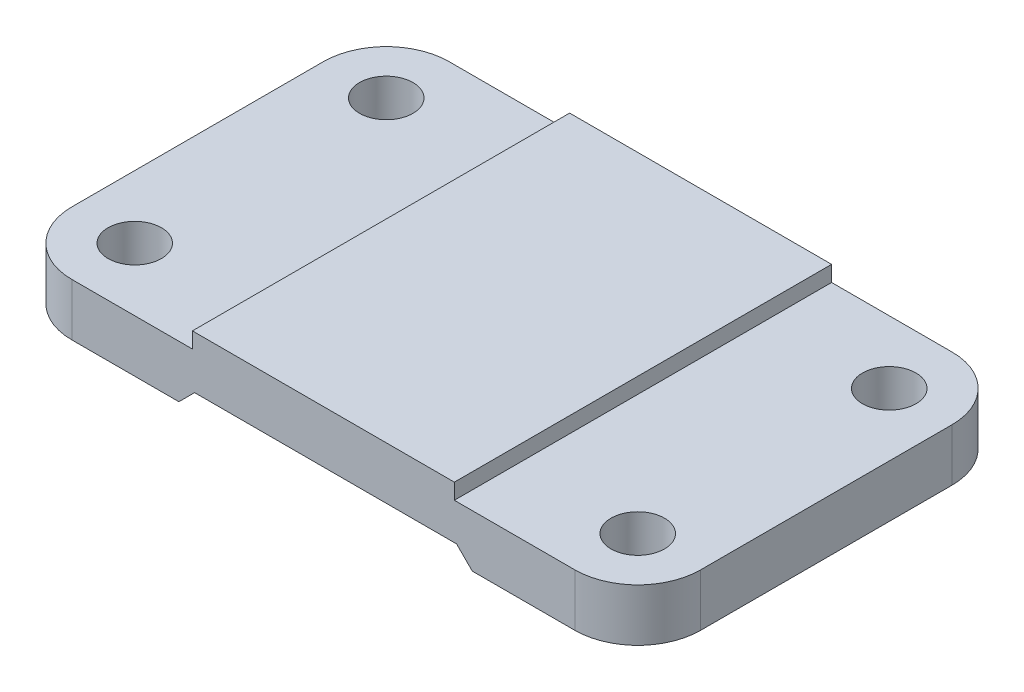
from build123d import *

# Parameters (mm, degrees)
SALIENTE_EXTRUIR1_DEPTH = 72
CORTAR_EXTRUIR1_REACH   = 142.3
CROQUIS2_R              = 5.1
REDONDEO1_R             = 12


with BuildPart() as part:
    # Croquis1 → Saliente-Extruir1 (new body)
    with BuildSketch(Plane.XY):
        Polygon((0, 0), (0, 10), (35, 10), (35, 13), (85, 13), (85, 10), (120, 10), (120, 0), (88.420727571, 0), (85.420727571, 3), (35.420727571, 3), (32.420727571, 0), align=None)
    extrude(amount=SALIENTE_EXTRUIR1_DEPTH)

    # Croquis2 → Cortar-Extruir1 (cut, up to next)
    with BuildSketch(Plane(origin=(0, 10, 0), x_dir=(1, 0, 0), z_dir=(0, 1, 0)), mode=Mode.PRIVATE) as cortar_extruir1_sk1:
        with Locations(Location((12, -12, 0), (0, 0, 270))):
            Circle(CROQUIS2_R)
    cortar_extruir1_tool1 = extrude(cortar_extruir1_sk1.sketch, amount=-CORTAR_EXTRUIR1_REACH, mode=Mode.PRIVATE) & part.part
    # Croquis2 → Cortar-Extruir1 (cut, up to next)
    with BuildSketch(Plane(origin=(0, 10, 0), x_dir=(1, 0, 0), z_dir=(0, 1, 0)), mode=Mode.PRIVATE) as cortar_extruir1_sk2:
        with Locations(Location((12, -60, 0), (0, 0, 180))):
            Circle(CROQUIS2_R)
    cortar_extruir1_tool2 = extrude(cortar_extruir1_sk2.sketch, amount=-CORTAR_EXTRUIR1_REACH, mode=Mode.PRIVATE) & part.part
    # Croquis2 → Cortar-Extruir1 (cut, up to next)
    with BuildSketch(Plane(origin=(0, 10, 0), x_dir=(1, 0, 0), z_dir=(0, 1, 0)), mode=Mode.PRIVATE) as cortar_extruir1_sk3:
        with Locations(Location((108, -60, 0), (0, 0, 270))):
            Circle(CROQUIS2_R)
    cortar_extruir1_tool3 = extrude(cortar_extruir1_sk3.sketch, amount=-CORTAR_EXTRUIR1_REACH, mode=Mode.PRIVATE) & part.part
    # Croquis2 → Cortar-Extruir1 (cut, up to next)
    with BuildSketch(Plane(origin=(0, 10, 0), x_dir=(1, 0, 0), z_dir=(0, 1, 0)), mode=Mode.PRIVATE) as cortar_extruir1_sk4:
        with Locations(Location((108, -12, 0), (0, 0, 180))):
            Circle(CROQUIS2_R)
    cortar_extruir1_tool4 = extrude(cortar_extruir1_sk4.sketch, amount=-CORTAR_EXTRUIR1_REACH, mode=Mode.PRIVATE) & part.part
    add(cortar_extruir1_tool1.solids().sort_by_distance((12, 10, 12))[0], mode=Mode.SUBTRACT)
    add(cortar_extruir1_tool2.solids().sort_by_distance((12, 10, 60))[0], mode=Mode.SUBTRACT)
    add(cortar_extruir1_tool3.solids().sort_by_distance((108, 10, 60))[0], mode=Mode.SUBTRACT)
    add(cortar_extruir1_tool4.solids().sort_by_distance((108, 10, 12))[0], mode=Mode.SUBTRACT)

    # Redondeo1
    redondeo1_edges = [part.edges().sort_by_distance(p)[0] for p in [
        (0, 5, 0),
        (120, 5, 0),
        (120, 5, 72),
        (0, 5, 72),
    ]]
    fillet(redondeo1_edges, radius=REDONDEO1_R)


solid = part.part
